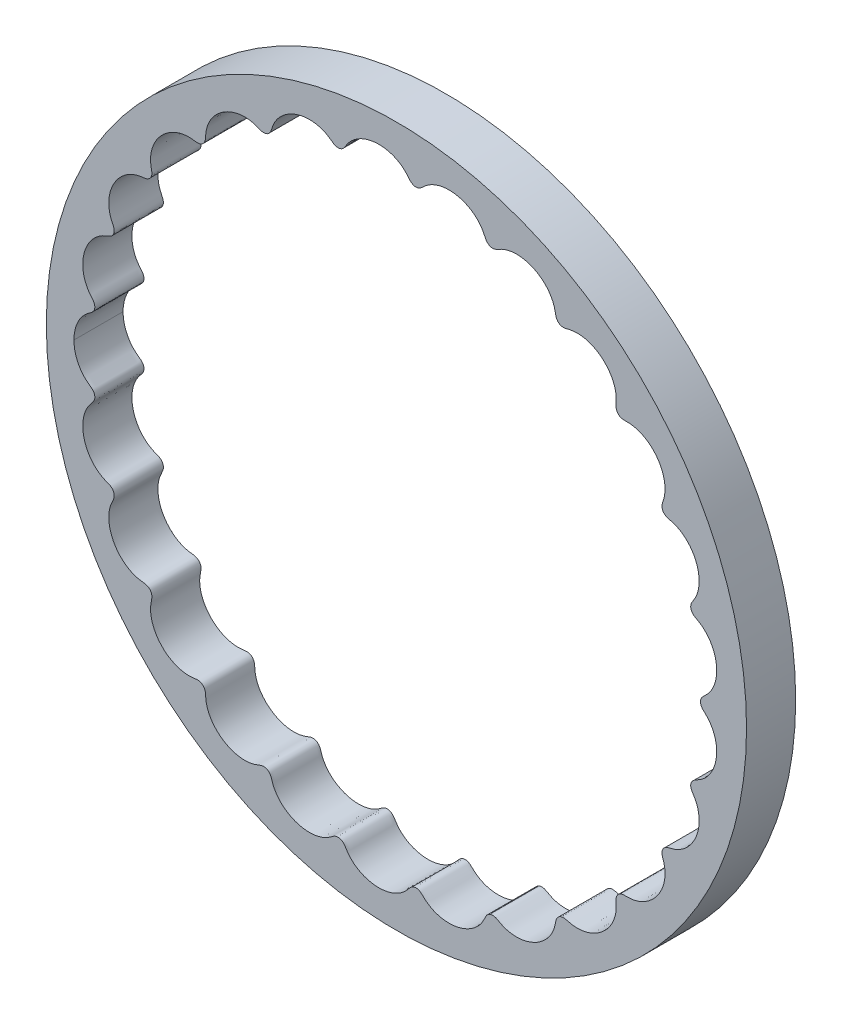
from build123d import *

# Parameters (mm, degrees)
ESQUISSE1_R        = 28.5
BOSS_EXTRU_1_DEPTH = 4


with BuildPart() as part:
    # Esquisse1 → Boss.-Extru.1 (new body)
    with BuildSketch(Plane.XY):
        Circle(ESQUISSE1_R)
        with BuildLine():
            add(Edge.make_bspline(
                [(24.75, 0), (24.75, -0.01190895), (24.750668659, -0.029768799), (24.75289752, -0.060006713), (24.758884934, -0.104774168), (24.767485304, -0.1467503), (24.785152354, -0.206071411), (24.818482478, -0.284185867), (24.880818803, -0.385919884), (24.984658612, -0.50047292), (25.114781066, -0.616600782), (25.255435339, -0.752464933), (25.419807145, -0.93333087), (25.594989864, -1.169106201), (25.768920192, -1.472936072), (25.920736133, -1.849650866), (26.023477253, -2.249860974), (26.074696747, -2.666946621), (26.073312156, -3.086313852), (26.020370658, -3.501501101), (25.917002683, -3.906273732), (25.764403676, -4.294347485), (25.566224565, -4.654785317), (25.325903213, -4.981499954), (25.081588671, -5.233067427), (24.851914535, -5.418631885), (24.667098284, -5.540217829), (24.539548747, -5.613941762), (24.410179088, -5.684594723), (24.273991814, -5.758046627), (24.120002912, -5.867762768), (23.989867, -6.050335584), (23.936355638, -6.275127193), (23.969192195, -6.495758333), (24.065351302, -6.684284012), (24.178449314, -6.851934675), (24.280144364, -7.019011908), (24.393570042, -7.235347013), (24.503436737, -7.50770452), (24.595094748, -7.84543671), (24.647032867, -8.248159789), (24.645694803, -8.661209862), (24.57595365, -9.185528563), (24.417645445, -9.696077248), (24.174741138, -10.176578568), (23.852030812, -10.610062282), (23.558837347, -10.90980476), (23.24095056, -11.157802847), (22.946586259, -11.329086722), (22.692113519, -11.440823192), (22.472657763, -11.513539342), (22.29388462, -11.561503733), (22.101259895, -11.606028638), (21.902055354, -11.681610724), (21.728453668, -11.828148656), (21.620885016, -12.038837081), (21.601595838, -12.263660858), (21.650481834, -12.469316746), (21.718254479, -12.659791435), (21.774584138, -12.84705718), (21.829677768, -13.084963879), (21.867201208, -13.376160202), (21.870688906, -13.725995236), (21.819474916, -14.128698884), (21.71419458, -14.527993453), (21.514773646, -15.017801417), (21.233133123, -15.4720736), (20.877140734, -15.876030958), (20.455657215, -16.214386724), (20.096354081, -16.430676116), (19.726170583, -16.590569736), (19.398076252, -16.68206281), (19.123633935, -16.725922166), (18.892914818, -16.74091163), (18.707848134, -16.742350192), (18.510091067, -16.737829569), (18.298399992, -16.764443666), (18.095471353, -16.866909122), (17.942147178, -17.047179332), (17.871387572, -17.261366287), (17.870202468, -17.472525416), (17.888313355, -17.673814374), (17.895669209, -17.869207586), (17.888886536, -18.113260777), (17.85168272, -18.404436203), (17.766823301, -18.743754438), (17.615819616, -19.120463832), (17.413434594, -19.48028858), (17.162321288, -19.816819375), (16.868500143, -20.122110223), (16.535786091, -20.390797243), (16.168397966, -20.617282366), (15.771042449, -20.795687849), (15.368766607, -20.914546396), (14.97017149, -20.975982916), (14.629556137, -20.981746846), (14.352921577, -20.954877105), (14.125857036, -20.911170138), (13.94640051, -20.866001244), (13.755772511, -20.812781493), (13.543469889, -20.788894817), (13.322238716, -20.84166807), (13.131407642, -20.981742865), (13.0130413, -21.173627181), (12.961818542, -21.378246364), (12.929064797, -21.57761534), (12.886990745, -21.768547341), (12.818791692, -22.002934942), (12.70930802, -22.275243379), (12.541628211, -22.582120244), (12.300626204, -22.908551746), (12.01422203, -23.205749325), (11.686582401, -23.4681837), (11.325453487, -23.689705246), (10.935854532, -23.866053147), (10.523258626, -23.992837457), (10.093696991, -24.06550579), (9.674368845, -24.079231972), (9.273085465, -24.038208914), (8.941983123, -23.957846351), (8.681067639, -23.861969077), (8.472360468, -23.762392874), (8.310008249, -23.673519219), (8.138322101, -23.574972467), (7.937182673, -23.501849574), (7.704899941, -23.502076627), (7.478095746, -23.600741865), (7.316947907, -23.77285878), (7.220831609, -23.97055906), (7.115634845, -24.203403783), (6.974300377, -24.460401189), (6.773045478, -24.737487424), (6.497851462, -25.02237666), (6.183428844, -25.270910892), (5.835740341, -25.479668636), (5.460328709, -25.645214949), (5.061542815, -25.765601822), (4.644666369, -25.83709061), (4.215744672, -25.855893135), (3.781608585, -25.818103671), (3.372294549, -25.725760832), (2.994169108, -25.584908149), (2.694109042, -25.423555897), (2.465647641, -25.264915254), (2.289085947, -25.115815571), (2.153739497, -24.989104422), (2.012318186, -24.851122457), (1.832423714, -24.733108156), (1.552983355, -24.66593755), (1.26214529, -24.754622086), (1.075414287, -24.957557798), (0.889090341, -25.194134228), (0.69672049, -25.401829912), (0.44758856, -25.61527269), (0.125683965, -25.821812182), (-0.224585626, -25.987068298), (-0.598975616, -26.109092558), (-0.990876156, -26.185347308), (-1.391941275, -26.2145582), (-1.796224618, -26.195837186), (-2.198144681, -26.128499562), (-2.591457519, -26.011923113), (-2.962803429, -25.848997421), (-3.306221845, -25.642423994), (-3.61537583, -25.39483403), (-3.850272783, -25.145621471), (-4.023133112, -24.908691884), (-4.156981332, -24.691054937), (-4.276293257, -24.506578487), (-4.456318725, -24.354528199), (-4.693068775, -24.282897531), (-4.923798246, -24.309710303), (-5.115035952, -24.406102337), (-5.273240645, -24.525178417), (-5.42301226, -24.633920894), (-5.617383402, -24.75923363), (-5.863981708, -24.887558689), (-6.182207181, -25.009385657), (-6.575059912, -25.101071531), (-6.9927825, -25.140689035), (-7.428136381, -25.123106217), (-7.851204623, -25.050059218), (-8.255644199, -24.926289526), (-8.635975215, -24.756290763), (-8.987390026, -24.544434268), (-9.305810055, -24.293211507), (-9.586131065, -24.006734367), (-9.822904508, -23.689158592), (-9.987239236, -23.388704672), (-10.094751199, -23.11580793), (-10.169610451, -22.871508954), (-10.24112571, -22.663502872), (-10.381175345, -22.473662137), (-10.594956363, -22.349311543), (-10.825624608, -22.322047042), (-11.033849204, -22.370890621), (-11.216381876, -22.447371753), (-11.388695767, -22.514940651), (-11.608352834, -22.58716666), (-11.87933894, -22.649041617), (-12.217942215, -22.68664221), (-12.621151131, -22.6763477), (-13.035301253, -22.609509201), (-13.452127793, -22.482943679), (-13.845292771, -22.304868342), (-14.20938889, -22.080540487), (-14.539531306, -21.814993299), (-14.831269767, -21.513076759), (-15.077661765, -21.181891436), (-15.275270226, -20.827454377), (-15.402577207, -20.501715906), (-15.476526159, -20.217667398), (-15.514326563, -19.976485954), (-15.531829272, -19.781749163), (-15.539202372, -19.579813227), (-15.565591069, -19.370421028), (-15.660806856, -19.1659885), (-15.83405536, -19.004717982), (-16.047591105, -18.926560558), (-16.261088064, -18.925182163), (-16.456798489, -18.954287053), (-16.640543184, -18.976331541), (-16.871307425, -18.990807395), (-17.149104778, -18.982241272), (-17.486194881, -18.933211709), (-17.873723074, -18.821638459), (-18.257615968, -18.652692803), (-18.629084532, -18.425342732), (-18.964764813, -18.15411038), (-19.260725449, -17.845401443), (-19.513475385, -17.50529118), (-19.719894943, -17.139574851), (-19.874988153, -16.756923442), (-19.976929286, -16.364037242), (-20.017953734, -16.016642642), (-20.017798024, -15.723070973), (-19.993447495, -15.480115157), (-19.96134753, -15.287225434), (-19.918054975, -15.089779832), (-19.89402871, -14.879875268), (-19.939362883, -14.658860507), (-20.070693635, -14.462043286), (-20.260249499, -14.336679591), (-20.467155514, -14.285214031), (-20.663881817, -14.2650629), (-20.847282484, -14.240161779), (-21.074211831, -14.195950386), (-21.340836688, -14.11751373), (-21.654611423, -13.985047804), (-22.001454707, -13.779432555), (-22.330360371, -13.519308084), (-22.705485211, -13.130240844), (-23.007369545, -12.684411231), (-23.229136266, -12.198075036), (-23.364819327, -11.686883469), (-23.418570267, -11.277399868), (-23.418213213, -10.871399708), (-23.370257339, -10.524800668), (-23.295965049, -10.240716159), (-23.211017087, -10.011726748), (-23.131365089, -9.833119484), (-23.040198426, -9.652618084), (-22.96715924, -9.454144986), (-22.960141523, -9.228680333), (-23.042373084, -9.007208297), (-23.198166311, -8.840665724), (-23.388940312, -8.741382585), (-23.57769294, -8.6722803), (-23.75308195, -8.599853942), (-23.966244513, -8.496298837), (-24.209343816, -8.347711506), (-24.48032477, -8.1355972), (-24.761295108, -7.846344695), (-25.008480075, -7.513349868), (-25.26655565, -7.04900195), (-25.442920247, -6.54763643), (-25.533949151, -6.025561479), (-25.536599067, -5.498854498), (-25.485486947, -5.088916426), (-25.382794666, -4.696000106), (-25.248906316, -4.372612425), (-25.105242941, -4.116427211), (-24.965170858, -3.916248887), (-24.843083512, -3.763442502), (-24.709834093, -3.611215538), (-24.591948067, -3.435387495), (-24.533798882, -3.220620895), (-24.560423715, -2.992589013), (-24.66665443, -2.797016304), (-24.822727104, -2.653701408), (-24.98966356, -2.53926073), (-25.146322188, -2.422077132), (-25.332496393, -2.263776399), (-25.502275925, -2.087254142), (-25.654526877, -1.895838833), (-25.79052351, -1.688263992), (-25.890012472, -1.511998867), (-25.978955887, -1.325507929), (-26.056614781, -1.131467198), (-26.121383307, -0.930707527), (-26.173241314, -0.729759288), (-26.207287779, -0.545661218), (-26.228372118, -0.39585777), (-26.240536879, -0.255725402), (-26.247025958, -0.16909655), (-26.249459241, -0.066739393), (-26.25, -0.022255367), (-26.25, 0)],
                knots=[0.07432085, 0.07432085, 0.07432085, 0.07432085, 0.07432085, 0.074838236, 0.075096929, 0.075355622, 0.075873009, 0.076390395, 0.077425167, 0.07845994, 0.080262761, 0.082065582, 0.083868403, 0.085671224, 0.089276866, 0.092882508, 0.096749545, 0.100616583, 0.104483621, 0.108350658, 0.112188336, 0.116026013, 0.11986369, 0.123701367, 0.12732655, 0.130951733, 0.132764324, 0.134576916, 0.135483211, 0.136389507, 0.138202099, 0.140295775, 0.142389451, 0.144458848, 0.146528245, 0.148330503, 0.150132762, 0.15193502, 0.153737278, 0.157341795, 0.160946311, 0.164812321, 0.16867833, 0.17254434, 0.180415799, 0.184421248, 0.188426697, 0.192432147, 0.195844027, 0.199255907, 0.200961848, 0.202667788, 0.204373728, 0.206079668, 0.208268892, 0.210458115, 0.21252702, 0.214595925, 0.216397713, 0.218199501, 0.220001289, 0.221803077, 0.225406654, 0.22901023, 0.232875219, 0.236740209, 0.240605199, 0.248476586, 0.252482983, 0.25648938, 0.260495777, 0.263907756, 0.267319735, 0.269025725, 0.270731714, 0.272437704, 0.274143693, 0.276335152, 0.278526612, 0.280594702, 0.282662792, 0.284464203, 0.286265613, 0.288067024, 0.289868435, 0.293471257, 0.297074079, 0.300938067, 0.304802055, 0.308666044, 0.312530032, 0.316537343, 0.320544653, 0.324551964, 0.328559274, 0.331971493, 0.335383713, 0.337089822, 0.338795932, 0.340502041, 0.342208151, 0.3444015, 0.346594848, 0.348661829, 0.35072881, 0.352529935, 0.354331061, 0.356132186, 0.357933311, 0.361535562, 0.365137813, 0.369000829, 0.372863844, 0.37672686, 0.380589876, 0.384598055, 0.388606234, 0.392614413, 0.396622592, 0.400035189, 0.403447785, 0.405154083, 0.406860381, 0.408566679, 0.410272977, 0.412467856, 0.414662735, 0.416905332, 0.41914793, 0.420947533, 0.422747136, 0.426346341, 0.429945547, 0.433544752, 0.437320979, 0.441097206, 0.444873433, 0.44864966, 0.452658654, 0.456667648, 0.460676642, 0.464685636, 0.468098738, 0.471511839, 0.473218389, 0.47492494, 0.476631491, 0.478338041, 0.480534086, 0.48273013, 0.487019518, 0.488748834, 0.49047815, 0.493936782, 0.497395414, 0.500854047, 0.504530334, 0.508206621, 0.511882908, 0.515559195, 0.519334982, 0.52311077, 0.526886557, 0.530662345, 0.534261527, 0.537860709, 0.541459892, 0.543259483, 0.545059074, 0.547300663, 0.549542252, 0.55173776, 0.553933267, 0.555639684, 0.5573461, 0.559052517, 0.560758933, 0.564171767, 0.5675846, 0.571593194, 0.575601788, 0.579610382, 0.583618976, 0.587395654, 0.591172332, 0.594949011, 0.598725689, 0.602324954, 0.605924219, 0.609523484, 0.611323117, 0.613122749, 0.615366313, 0.617609877, 0.619804036, 0.621998195, 0.623704391, 0.625410586, 0.627116782, 0.628822977, 0.632235368, 0.635647759, 0.63965551, 0.643663261, 0.647671012, 0.651678763, 0.655542261, 0.659405759, 0.663269257, 0.667132755, 0.670735268, 0.674337782, 0.676139039, 0.677940295, 0.679741552, 0.681542809, 0.683610379, 0.685677949, 0.687870397, 0.690062845, 0.691768886, 0.693474927, 0.695180968, 0.696887009, 0.700299091, 0.703711172, 0.707718031, 0.71172489, 0.715731748, 0.719738607, 0.723603093, 0.727467579, 0.731332066, 0.735196552, 0.738799727, 0.742402903, 0.744204491, 0.746006079, 0.747807667, 0.749609255, 0.751677791, 0.753746327, 0.755936711, 0.758127095, 0.75983305, 0.761539006, 0.763244962, 0.764950918, 0.76836283, 0.771774741, 0.775780668, 0.779786595, 0.783792522, 0.791663947, 0.795529445, 0.799394943, 0.803260441, 0.806864464, 0.810468487, 0.812270499, 0.81407251, 0.815874522, 0.817676533, 0.819745726, 0.821814919, 0.823998833, 0.826182748, 0.827931402, 0.829680057, 0.831428712, 0.833177366, 0.836674676, 0.840171985, 0.844093542, 0.8480151, 0.851936657, 0.859724738, 0.863591261, 0.867457784, 0.871324307, 0.874929364, 0.87853442, 0.880336948, 0.882139476, 0.883942004, 0.885744532, 0.887814048, 0.889883563, 0.891953048, 0.894022532, 0.895825669, 0.897628805, 0.899431941, 0.901235078, 0.90484135, 0.906644487, 0.908447623, 0.910381399, 0.912315175, 0.914248951, 0.916182727, 0.918116503, 0.920050278, 0.921017166, 0.921984054, 0.922950942, 0.92391783, 0.92391783, 0.92391783, 0.92391783, 0.92391783], degree=4))
            add(Edge.make_bspline(
                [(24.75, 0), (24.75, 0.01190895), (24.750668659, 0.029768799), (24.75289752, 0.060006713), (24.758884934, 0.104774168), (24.767485304, 0.1467503), (24.785152354, 0.206071411), (24.818482478, 0.284185867), (24.880818803, 0.385919884), (24.984658612, 0.50047292), (25.114781066, 0.616600782), (25.255435339, 0.752464933), (25.419807145, 0.93333087), (25.594989864, 1.169106201), (25.768920192, 1.472936072), (25.920736133, 1.849650866), (26.023477253, 2.249860974), (26.074696747, 2.666946621), (26.073312156, 3.086313852), (26.020370658, 3.501501101), (25.917002683, 3.906273732), (25.764403676, 4.294347485), (25.566224565, 4.654785317), (25.325903213, 4.981499954), (25.081588671, 5.233067427), (24.851914535, 5.418631885), (24.667098284, 5.540217829), (24.539548747, 5.613941762), (24.410179088, 5.684594723), (24.273991814, 5.758046627), (24.120002912, 5.867762768), (23.989867, 6.050335584), (23.936355638, 6.275127193), (23.969192195, 6.495758333), (24.065351302, 6.684284012), (24.178449314, 6.851934675), (24.280144364, 7.019011908), (24.393570042, 7.235347013), (24.503436737, 7.50770452), (24.595094748, 7.84543671), (24.647032867, 8.248159789), (24.645694803, 8.661209862), (24.57595365, 9.185528563), (24.417645445, 9.696077248), (24.174741138, 10.176578568), (23.852030812, 10.610062282), (23.558837347, 10.90980476), (23.24095056, 11.157802847), (22.946586259, 11.329086722), (22.692113519, 11.440823192), (22.472657763, 11.513539342), (22.29388462, 11.561503733), (22.101259895, 11.606028638), (21.902055354, 11.681610724), (21.728453668, 11.828148656), (21.620885016, 12.038837081), (21.601595838, 12.263660858), (21.650481834, 12.469316746), (21.718254479, 12.659791435), (21.774584138, 12.84705718), (21.829677768, 13.084963879), (21.867201208, 13.376160202), (21.870688906, 13.725995236), (21.819474916, 14.128698884), (21.71419458, 14.527993453), (21.514773646, 15.017801417), (21.233133123, 15.4720736), (20.877140734, 15.876030958), (20.455657215, 16.214386724), (20.096354081, 16.430676116), (19.726170583, 16.590569736), (19.398076252, 16.68206281), (19.123633935, 16.725922166), (18.892914818, 16.74091163), (18.707848134, 16.742350192), (18.510091067, 16.737829569), (18.298399992, 16.764443666), (18.095471353, 16.866909122), (17.942147178, 17.047179332), (17.871387572, 17.261366287), (17.870202468, 17.472525416), (17.888313355, 17.673814374), (17.895669209, 17.869207586), (17.888886536, 18.113260777), (17.85168272, 18.404436203), (17.766823301, 18.743754438), (17.615819616, 19.120463832), (17.413434594, 19.48028858), (17.162321288, 19.816819375), (16.868500143, 20.122110223), (16.535786091, 20.390797243), (16.168397966, 20.617282366), (15.771042449, 20.795687849), (15.368766607, 20.914546396), (14.97017149, 20.975982916), (14.629556137, 20.981746846), (14.352921577, 20.954877105), (14.125857036, 20.911170138), (13.94640051, 20.866001244), (13.755772511, 20.812781493), (13.543469889, 20.788894817), (13.322238716, 20.84166807), (13.131407642, 20.981742865), (13.0130413, 21.173627181), (12.961818542, 21.378246364), (12.929064797, 21.57761534), (12.886990745, 21.768547341), (12.818791692, 22.002934942), (12.70930802, 22.275243379), (12.541628211, 22.582120244), (12.300626204, 22.908551746), (12.01422203, 23.205749325), (11.686582401, 23.4681837), (11.325453487, 23.689705246), (10.935854532, 23.866053147), (10.523258626, 23.992837457), (10.093696991, 24.06550579), (9.674368845, 24.079231972), (9.273085465, 24.038208914), (8.941983123, 23.957846351), (8.681067639, 23.861969077), (8.472360468, 23.762392874), (8.310008249, 23.673519219), (8.138322101, 23.574972467), (7.937182673, 23.501849574), (7.704899941, 23.502076627), (7.478095746, 23.600741865), (7.316947907, 23.772858779), (7.220831609, 23.97055906), (7.115634845, 24.203403783), (6.974300377, 24.460401189), (6.773045477, 24.737487424), (6.497851462, 25.02237666), (6.183428844, 25.270910892), (5.835740341, 25.479668636), (5.460328709, 25.645214949), (5.061542815, 25.765601822), (4.644666369, 25.83709061), (4.215744672, 25.855893135), (3.781608585, 25.818103671), (3.372294549, 25.725760832), (2.994169108, 25.584908149), (2.694109042, 25.423555897), (2.465647641, 25.264915254), (2.289085947, 25.115815571), (2.153739497, 24.989104422), (2.012318186, 24.851122457), (1.832423714, 24.733108156), (1.552983354, 24.66593755), (1.26214529, 24.754622086), (1.075414287, 24.957557798), (0.889090341, 25.194134228), (0.69672049, 25.401829912), (0.44758856, 25.61527269), (0.125683965, 25.821812182), (-0.224585626, 25.987068298), (-0.598975616, 26.109092558), (-0.990876156, 26.185347308), (-1.391941275, 26.2145582), (-1.796224618, 26.195837186), (-2.198144681, 26.128499562), (-2.591457519, 26.011923113), (-2.962803429, 25.848997421), (-3.306221845, 25.642423994), (-3.61537583, 25.39483403), (-3.850272783, 25.145621471), (-4.023133112, 24.908691884), (-4.156981332, 24.691054937), (-4.276293257, 24.506578487), (-4.456318725, 24.354528199), (-4.693068775, 24.282897531), (-4.923798246, 24.309710303), (-5.115035952, 24.406102337), (-5.273240646, 24.525178417), (-5.42301226, 24.633920894), (-5.617383402, 24.75923363), (-5.863981708, 24.887558689), (-6.182207181, 25.009385657), (-6.575059912, 25.101071531), (-6.9927825, 25.140689035), (-7.428136381, 25.123106217), (-7.851204623, 25.050059218), (-8.255644199, 24.926289526), (-8.635975215, 24.756290763), (-8.987390026, 24.544434268), (-9.305810055, 24.293211507), (-9.586131065, 24.006734367), (-9.822904508, 23.689158592), (-9.987239236, 23.388704672), (-10.094751199, 23.11580793), (-10.169610451, 22.871508954), (-10.24112571, 22.663502872), (-10.381175345, 22.473662137), (-10.594956363, 22.349311543), (-10.825624608, 22.322047042), (-11.033849204, 22.370890621), (-11.216381876, 22.447371753), (-11.388695767, 22.514940651), (-11.608352834, 22.58716666), (-11.87933894, 22.649041617), (-12.217942215, 22.68664221), (-12.621151131, 22.676347699), (-13.035301253, 22.609509201), (-13.452127793, 22.482943679), (-13.845292771, 22.304868342), (-14.20938889, 22.080540487), (-14.539531306, 21.814993299), (-14.831269767, 21.513076759), (-15.077661765, 21.181891436), (-15.275270226, 20.827454377), (-15.402577207, 20.501715906), (-15.476526159, 20.217667398), (-15.514326563, 19.976485954), (-15.531829272, 19.781749163), (-15.539202372, 19.579813227), (-15.565591069, 19.370421028), (-15.660806856, 19.1659885), (-15.83405536, 19.004717982), (-16.047591105, 18.926560558), (-16.261088064, 18.925182163), (-16.456798489, 18.954287053), (-16.640543184, 18.976331541), (-16.871307425, 18.990807395), (-17.149104778, 18.982241272), (-17.486194881, 18.933211709), (-17.873723074, 18.821638459), (-18.257615968, 18.652692802), (-18.629084532, 18.425342732), (-18.964764813, 18.15411038), (-19.260725449, 17.845401443), (-19.513475385, 17.50529118), (-19.719894943, 17.139574851), (-19.874988153, 16.756923442), (-19.976929286, 16.364037242), (-20.017953734, 16.016642642), (-20.017798024, 15.723070973), (-19.993447495, 15.480115157), (-19.96134753, 15.287225434), (-19.918054975, 15.089779832), (-19.89402871, 14.879875268), (-19.939362883, 14.658860507), (-20.070693635, 14.462043286), (-20.260249499, 14.336679591), (-20.467155514, 14.285214031), (-20.663881817, 14.2650629), (-20.847282484, 14.240161779), (-21.074211831, 14.195950386), (-21.340836688, 14.11751373), (-21.654611423, 13.985047804), (-22.001454707, 13.779432555), (-22.330360371, 13.519308084), (-22.705485211, 13.130240844), (-23.007369545, 12.684411231), (-23.229136266, 12.198075036), (-23.364819327, 11.686883469), (-23.418570267, 11.277399868), (-23.418213213, 10.871399708), (-23.370257339, 10.524800667), (-23.295965049, 10.240716159), (-23.211017087, 10.011726748), (-23.131365089, 9.833119484), (-23.040198426, 9.652618084), (-22.96715924, 9.454144986), (-22.960141523, 9.228680333), (-23.042373084, 9.007208297), (-23.198166311, 8.840665724), (-23.388940312, 8.741382585), (-23.57769294, 8.6722803), (-23.75308195, 8.599853942), (-23.966244513, 8.496298837), (-24.209343816, 8.347711506), (-24.48032477, 8.1355972), (-24.761295108, 7.846344695), (-25.008480075, 7.513349868), (-25.26655565, 7.04900195), (-25.442920247, 6.54763643), (-25.533949151, 6.025561479), (-25.536599067, 5.498854498), (-25.485486947, 5.088916426), (-25.382794666, 4.696000106), (-25.248906316, 4.372612425), (-25.105242941, 4.116427211), (-24.965170858, 3.916248887), (-24.843083512, 3.763442502), (-24.709834093, 3.611215538), (-24.591948067, 3.435387495), (-24.533798882, 3.220620895), (-24.560423715, 2.992589013), (-24.66665443, 2.797016303), (-24.822727104, 2.653701408), (-24.98966356, 2.53926073), (-25.146322188, 2.422077132), (-25.332496393, 2.263776399), (-25.502275925, 2.087254142), (-25.654526877, 1.895838833), (-25.79052351, 1.688263992), (-25.890012472, 1.511998867), (-25.978955887, 1.325507929), (-26.056614781, 1.131467198), (-26.121383307, 0.930707527), (-26.173241314, 0.729759288), (-26.207287779, 0.545661218), (-26.228372118, 0.39585777), (-26.240536879, 0.255725402), (-26.247025958, 0.16909655), (-26.249459241, 0.066739393), (-26.25, 0.022255367), (-26.25, 0)],
                knots=[0.07432085, 0.07432085, 0.07432085, 0.07432085, 0.07432085, 0.074838236, 0.075096929, 0.075355622, 0.075873009, 0.076390395, 0.077425167, 0.07845994, 0.080262761, 0.082065582, 0.083868403, 0.085671224, 0.089276866, 0.092882508, 0.096749545, 0.100616583, 0.104483621, 0.108350658, 0.112188336, 0.116026013, 0.11986369, 0.123701367, 0.12732655, 0.130951733, 0.132764324, 0.134576916, 0.135483211, 0.136389507, 0.138202099, 0.140295775, 0.142389451, 0.144458848, 0.146528245, 0.148330503, 0.150132762, 0.15193502, 0.153737278, 0.157341795, 0.160946311, 0.164812321, 0.16867833, 0.17254434, 0.180415799, 0.184421248, 0.188426697, 0.192432147, 0.195844027, 0.199255907, 0.200961848, 0.202667788, 0.204373728, 0.206079668, 0.208268892, 0.210458115, 0.21252702, 0.214595925, 0.216397713, 0.218199501, 0.220001289, 0.221803077, 0.225406654, 0.22901023, 0.232875219, 0.236740209, 0.240605199, 0.248476586, 0.252482983, 0.25648938, 0.260495777, 0.263907756, 0.267319735, 0.269025725, 0.270731714, 0.272437704, 0.274143693, 0.276335152, 0.278526612, 0.280594702, 0.282662792, 0.284464203, 0.286265613, 0.288067024, 0.289868435, 0.293471257, 0.297074079, 0.300938067, 0.304802055, 0.308666044, 0.312530032, 0.316537343, 0.320544653, 0.324551964, 0.328559274, 0.331971493, 0.335383713, 0.337089822, 0.338795932, 0.340502041, 0.342208151, 0.3444015, 0.346594848, 0.348661829, 0.35072881, 0.352529935, 0.354331061, 0.356132186, 0.357933311, 0.361535562, 0.365137813, 0.369000829, 0.372863844, 0.37672686, 0.380589876, 0.384598055, 0.388606234, 0.392614413, 0.396622592, 0.400035189, 0.403447785, 0.405154083, 0.406860381, 0.408566679, 0.410272977, 0.412467856, 0.414662735, 0.416905332, 0.41914793, 0.420947533, 0.422747136, 0.426346341, 0.429945547, 0.433544752, 0.437320979, 0.441097206, 0.444873433, 0.44864966, 0.452658654, 0.456667648, 0.460676642, 0.464685636, 0.468098738, 0.471511839, 0.473218389, 0.47492494, 0.476631491, 0.478338041, 0.480534086, 0.48273013, 0.487019518, 0.488748834, 0.49047815, 0.493936782, 0.497395414, 0.500854047, 0.504530334, 0.508206621, 0.511882908, 0.515559195, 0.519334982, 0.52311077, 0.526886557, 0.530662345, 0.534261527, 0.537860709, 0.541459892, 0.543259483, 0.545059074, 0.547300663, 0.549542252, 0.55173776, 0.553933267, 0.555639684, 0.5573461, 0.559052517, 0.560758933, 0.564171767, 0.5675846, 0.571593194, 0.575601788, 0.579610382, 0.583618976, 0.587395654, 0.591172332, 0.594949011, 0.598725689, 0.602324954, 0.605924219, 0.609523484, 0.611323117, 0.613122749, 0.615366313, 0.617609877, 0.619804036, 0.621998195, 0.623704391, 0.625410586, 0.627116782, 0.628822977, 0.632235368, 0.635647759, 0.63965551, 0.643663261, 0.647671012, 0.651678763, 0.655542261, 0.659405759, 0.663269257, 0.667132755, 0.670735268, 0.674337782, 0.676139039, 0.677940295, 0.679741552, 0.681542809, 0.683610379, 0.685677949, 0.687870397, 0.690062845, 0.691768886, 0.693474927, 0.695180968, 0.696887009, 0.700299091, 0.703711172, 0.707718031, 0.71172489, 0.715731748, 0.719738607, 0.723603093, 0.727467579, 0.731332066, 0.735196552, 0.738799727, 0.742402903, 0.744204491, 0.746006079, 0.747807667, 0.749609255, 0.751677791, 0.753746327, 0.755936711, 0.758127095, 0.75983305, 0.761539006, 0.763244962, 0.764950918, 0.76836283, 0.771774741, 0.775780668, 0.779786595, 0.783792522, 0.791663947, 0.795529445, 0.799394943, 0.803260441, 0.806864464, 0.810468487, 0.812270499, 0.81407251, 0.815874522, 0.817676533, 0.819745726, 0.821814919, 0.823998833, 0.826182748, 0.827931402, 0.829680057, 0.831428712, 0.833177366, 0.836674676, 0.840171985, 0.844093542, 0.8480151, 0.851936657, 0.859724738, 0.863591261, 0.867457784, 0.871324307, 0.874929364, 0.87853442, 0.880336948, 0.882139476, 0.883942004, 0.885744532, 0.887814048, 0.889883563, 0.891953048, 0.894022532, 0.895825669, 0.897628805, 0.899431941, 0.901235078, 0.90484135, 0.906644487, 0.908447623, 0.910381399, 0.912315175, 0.914248951, 0.916182727, 0.918116503, 0.920050278, 0.921017166, 0.921984054, 0.922950942, 0.92391783, 0.92391783, 0.92391783, 0.92391783, 0.92391783], degree=4))
        make_face(mode=Mode.SUBTRACT)
    extrude(amount=BOSS_EXTRU_1_DEPTH)


solid = part.part
